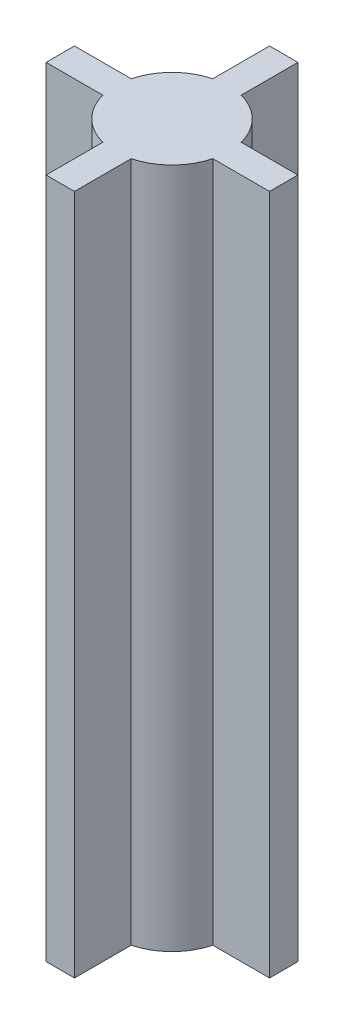
from build123d import *

# Parameters (mm, degrees)
BOSS_EXTRUDE1_DEPTH = 152.4


with BuildPart() as part:
    # Sketch1 → Boss-Extrude1 (new body)
    with BuildSketch(Plane(origin=(0, 0, 0), x_dir=(1, 0, 0), z_dir=(0, 1, 0))):
        with BuildLine():
            ThreePointArc((3.175, 12.296722124), (0, 12.7), (-3.175, 12.296722124))
            Line((-3.175, 12.296722124), (3.175, 12.296722124))
        make_face()
        with BuildLine():
            Line((3.175, 12.296722124), (-3.175, 12.296722124))
            ThreePointArc((-3.175, 12.296722124), (-8.980256121, 8.980256121), (-12.296722124, 3.175))
            ThreePointArc((-12.296722124, 3.175), (-12.7, 0), (-12.296722124, -3.175))
            ThreePointArc((-12.296722124, -3.175), (-8.980256121, -8.980256121), (-3.175, -12.296722124))
            ThreePointArc((-3.175, -12.296722124), (0, -12.7), (3.175, -12.296722124))
            ThreePointArc((3.175, -12.296722124), (8.980256121, -8.980256121), (12.296722124, -3.175))
            ThreePointArc((12.296722124, -3.175), (12.598777143, -1.600254515), (12.7, 0))
            ThreePointArc((12.7, 0), (12.598777143, 1.600254515), (12.296722124, 3.175))
            ThreePointArc((12.296722124, 3.175), (8.980256121, 8.980256121), (3.175, 12.296722124))
        make_face()
        with BuildLine():
            ThreePointArc((-12.296722124, -3.175), (-12.7, 0), (-12.296722124, 3.175))
            Line((-12.296722124, 3.175), (-24.996722124, 3.175))
            Line((-24.996722124, 3.175), (-24.996722124, -3.175))
            Line((-24.996722124, -3.175), (-12.296722124, -3.175))
        make_face()
        with BuildLine():
            ThreePointArc((3.175, -12.296722124), (0, -12.7), (-3.175, -12.296722124))
            Line((-3.175, -12.296722124), (-3.175, -24.996722124))
            Line((-3.175, -24.996722124), (3.175, -24.996722124))
            Line((3.175, -24.996722124), (3.175, -12.296722124))
        make_face()
        with BuildLine():
            Line((24.996722124, 3.175), (12.296722124, 3.175))
            ThreePointArc((12.296722124, 3.175), (12.598777143, 1.600254515), (12.7, 0))
            ThreePointArc((12.7, 0), (12.598777143, -1.600254515), (12.296722124, -3.175))
            Line((12.296722124, -3.175), (24.996722124, -3.175))
            Line((24.996722124, -3.175), (24.996722124, 3.175))
        make_face()
        with BuildLine():
            Line((-3.175, 24.996722124), (-3.175, 12.296722124))
            ThreePointArc((-3.175, 12.296722124), (0, 12.7), (3.175, 12.296722124))
            Line((3.175, 12.296722124), (3.175, 24.996722124))
            Line((3.175, 24.996722124), (-3.175, 24.996722124))
        make_face()
    extrude(amount=BOSS_EXTRUDE1_DEPTH)


solid = part.part
